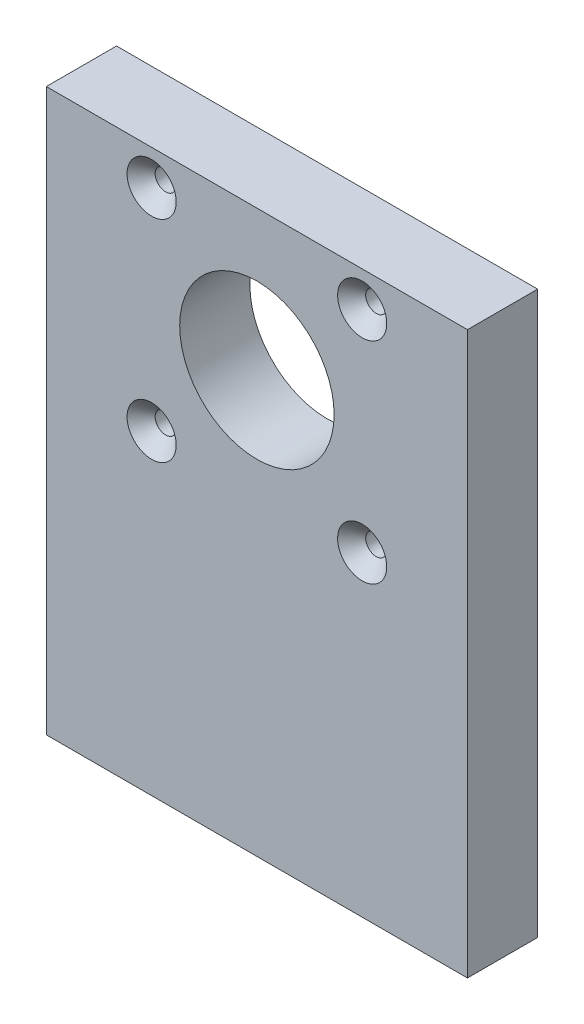
from build123d import *

# Parameters (mm, degrees)
SKETCH1_W                 = 60
SKETCH1_H                 = 80
SKETCH1_R                 = 11
SKETCH1_R_2               = 1.5
BOSS_EXTRUDE1_DEPTH       = 10
M4X0_7_TAPPED_HOLE1_D     = 3.3
M4X0_7_TAPPED_HOLE1_DEPTH = 10.1
M4X0_7_TAPPED_HOLE1_TIP   = 0.991420021
CHAMFER1_SIZE             = 2


with BuildPart() as part:
    # Sketch1 → Boss-Extrude1 (new body)
    with BuildSketch(Plane.XY):
        with Locations((30, 40)):
            Rectangle(SKETCH1_W, SKETCH1_H)
        with Locations((30, 60)):
            Circle(SKETCH1_R, mode=Mode.SUBTRACT)
        with Locations((15, 75)):
            Circle(SKETCH1_R_2, mode=Mode.SUBTRACT)
        with Locations((45, 75)):
            Circle(SKETCH1_R_2, mode=Mode.SUBTRACT)
        with Locations((45, 45)):
            Circle(SKETCH1_R_2, mode=Mode.SUBTRACT)
        with Locations((15, 45)):
            Circle(SKETCH1_R_2, mode=Mode.SUBTRACT)
    extrude(amount=BOSS_EXTRUDE1_DEPTH)

    # M4x0.7 Tapped Hole1
    with Locations(Plane(origin=(0, 0, 0), x_dir=(-1, 0, 0), z_dir=(0, -1, 0))):
        with Locations((-8, -5), (-30, -5), (-52, -5)):
            Hole(M4X0_7_TAPPED_HOLE1_D / 2, depth=M4X0_7_TAPPED_HOLE1_DEPTH)
            with Locations((0, 0, -(M4X0_7_TAPPED_HOLE1_DEPTH + M4X0_7_TAPPED_HOLE1_TIP / 2))):  # 118° drill point
                Cone(0, M4X0_7_TAPPED_HOLE1_D / 2, M4X0_7_TAPPED_HOLE1_TIP, mode=Mode.SUBTRACT)

    # Chamfer1
    chamfer1_edges = [part.edges().sort_by_distance(p)[0] for p in [
        (13.5, 75, 10),
        (43.5, 75, 10),
        (43.5, 45, 10),
        (13.5, 45, 10),
    ]]
    chamfer(chamfer1_edges, length=CHAMFER1_SIZE)


solid = part.part
